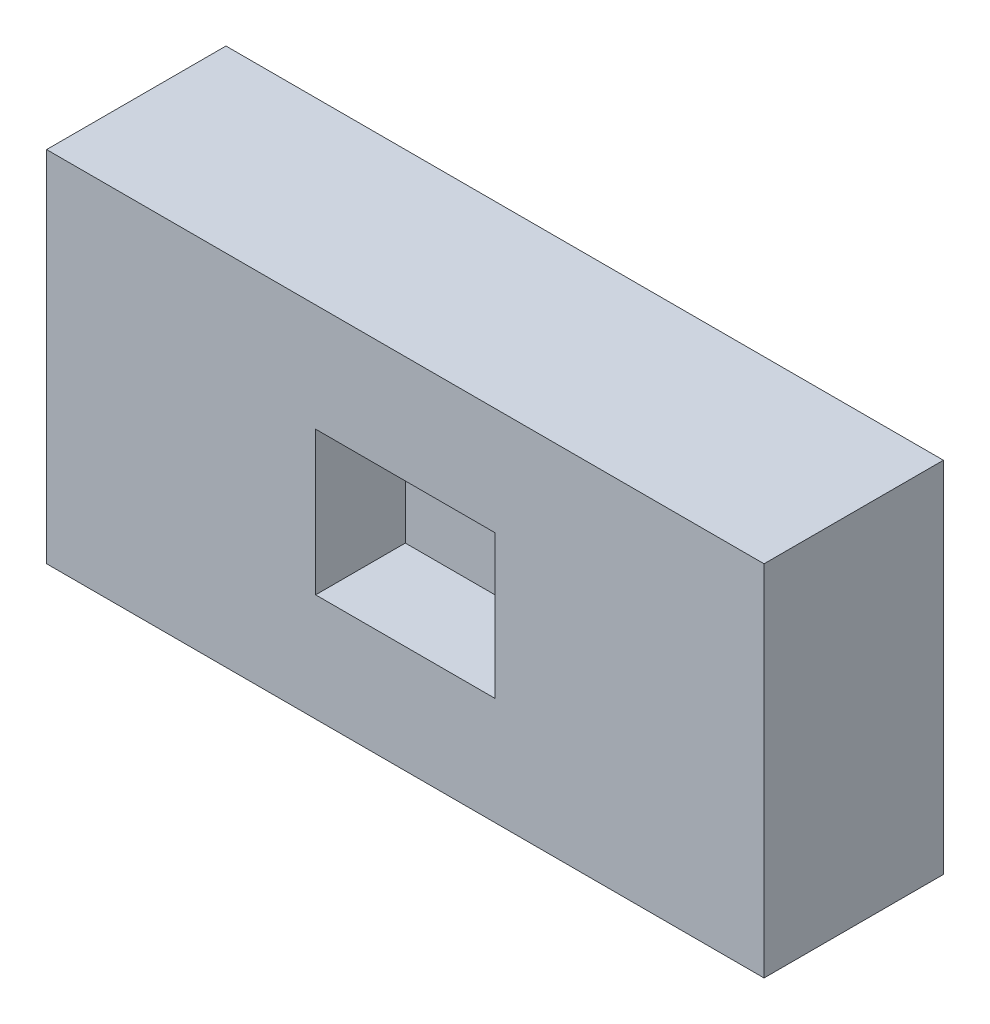
from build123d import *

# Parameters (mm, degrees)
RECTANGLESKETCH_W = 40
RECTANGLESKETCH_H = 20
BLINDBOSS_DEPTH   = 10
CUTSKETCH_W       = 10
CUTSKETCH_H       = 8
BLINDCUT_DEPTH    = 5


with BuildPart() as part:
    # RectangleSketch → BlindBoss (new body)
    with BuildSketch(Plane.XY):
        with Locations((20, 10)):
            Rectangle(RECTANGLESKETCH_W, RECTANGLESKETCH_H)
    extrude(amount=BLINDBOSS_DEPTH)

    # CutSketch → BlindCut (cut)
    with BuildSketch(Plane.XY.offset(10)):
        with Locations((20, 10)):
            Rectangle(CUTSKETCH_W, CUTSKETCH_H)
    extrude(amount=-BLINDCUT_DEPTH, mode=Mode.SUBTRACT)


solid = part.part
